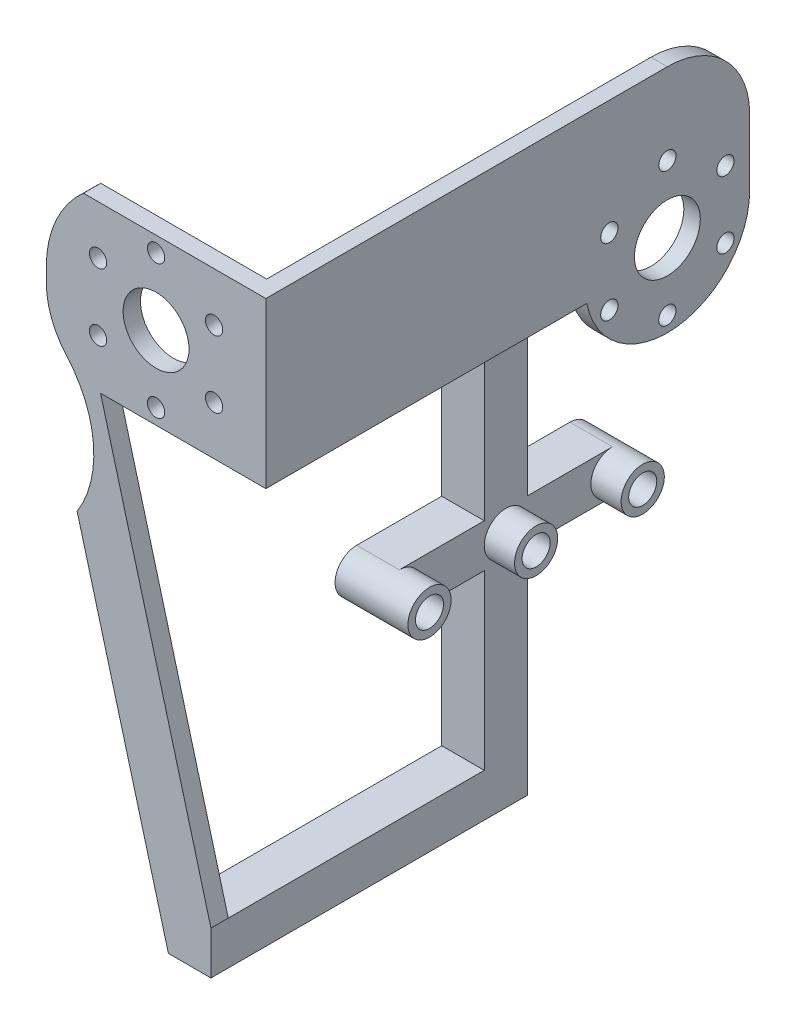
from build123d import *

# Parameters (mm, degrees)
SKETCH1_W                = 50.8
SKETCH1_H                = 38.1
SKETCH1_R                = 2
SKETCH1_R_2              = 7.62
BOSS_EXTRUDE1_DEPTH      = 4
CUT_EXTRUDE1_REACH       = 34.001
SKETCH4_R                = 19.05
SKETCH4_W                = 92.9
SKETCH4_H                = 38.1
SKETCH4_W_2              = 38.1
SKETCH4_H_2              = 15.24
BOSS_EXTRUDE2_DEPTH      = 3.81
CUT_EXTRUDE2_REACH       = 126.136
SKETCH5_R                = 7.62
SKETCH5_R_2              = 2
SKETCH6_W                = 19.05
SKETCH6_H                = 10
BOSS_EXTRUDE3_DEPTH      = 10
BOSS_EXTRUDE6_DEPTH      = 3.5
BOSS_EXTRUDE6_DEPTH_BACK = 6.35
SKETCH9_R                = 3.25
BOSS_EXTRUDE7_START      = 7
SKETCH10_R               = 5
SKETCH10_R_2             = 3.25
BOSS_EXTRUDE7_DEPTH      = 7
SKETCH11_W               = 10
SKETCH11_H               = 10
BOSS_EXTRUDE8_DEPTH      = 3.5
SKETCH12_W               = 63.23488816
SKETCH12_H               = 10
BOSS_EXTRUDE9_DEPTH      = 9.85
BOSS_EXTRUDE11_DEPTH     = 4
CUT_EXTRUDE3_DEPTH       = 4


with BuildPart() as part:
    # Sketch1 → Boss-Extrude1 (new body)
    with BuildSketch(Plane.XY):
        Rectangle(SKETCH1_W, SKETCH1_H)
        with Locations((0, 15.5)):
            Circle(SKETCH1_R, mode=Mode.SUBTRACT)
        with Locations((13.423393759, 7.75)):
            Circle(SKETCH1_R, mode=Mode.SUBTRACT)
        with Locations((13.423393759, -7.75)):
            Circle(SKETCH1_R, mode=Mode.SUBTRACT)
        with Locations((0, -15.5)):
            Circle(SKETCH1_R, mode=Mode.SUBTRACT)
        with Locations((-13.423393759, -7.75)):
            Circle(SKETCH1_R, mode=Mode.SUBTRACT)
        with Locations((-13.423393759, 7.75)):
            Circle(SKETCH1_R, mode=Mode.SUBTRACT)
        Circle(SKETCH1_R_2, mode=Mode.SUBTRACT)
    extrude(amount=BOSS_EXTRUDE1_DEPTH)

    # Sketch2 → Cut-Extrude1 (cut, up to next)
    with BuildSketch(Plane.XY.offset(4), mode=Mode.PRIVATE) as cut_extrude1_sk1:
        with BuildLine():
            Line((-16.800520825, 19.05), (-25.4, 19.05))
            Line((-25.4, 19.05), (-25.4, 0))
            ThreePointArc((-25.4, 0), (-23.150520825, 10.450520825), (-16.800520825, 19.05))
        make_face()
    cut_extrude1_tool1 = extrude(cut_extrude1_sk1.sketch, amount=-CUT_EXTRUDE1_REACH, mode=Mode.PRIVATE) & part.part
    add(cut_extrude1_tool1.solids().sort_by_distance((-22.917267, 14.463782, 4))[0], mode=Mode.SUBTRACT)

    # Sketch4 → Boss-Extrude2 (add)
    with BuildSketch(Plane(origin=(25.4, 0, 0), x_dir=(0, 0, -1), z_dir=(1, 0, 0))):
        with Locations((88.9, 0)):
            Circle(SKETCH4_R)
        with Locations((88.9, -15.24)):
            Circle(SKETCH4_R)
        with Locations((42.45, 0)):
            Rectangle(SKETCH4_W, SKETCH4_H)
        with Locations((88.9, -7.62)):
            Rectangle(SKETCH4_W_2, SKETCH4_H_2)
    extrude(amount=-BOSS_EXTRUDE2_DEPTH)

    # Sketch5 → Cut-Extrude2 (cut, up to next)
    with BuildSketch(Plane(origin=(25.4, 0, 0), x_dir=(0, 0, -1), z_dir=(1, 0, 0)), mode=Mode.PRIVATE) as cut_extrude2_sk1:
        with Locations((88.9, -15.24)):
            Circle(SKETCH5_R)
    cut_extrude2_tool1 = extrude(cut_extrude2_sk1.sketch, amount=-CUT_EXTRUDE2_REACH, mode=Mode.PRIVATE) & part.part
    # Sketch5 → Cut-Extrude2 (cut, up to next)
    with BuildSketch(Plane(origin=(25.4, 0, 0), x_dir=(0, 0, -1), z_dir=(1, 0, 0)), mode=Mode.PRIVATE) as cut_extrude2_sk2:
        with Locations((88.9, 0.26)):
            Circle(SKETCH5_R_2)
    cut_extrude2_tool2 = extrude(cut_extrude2_sk2.sketch, amount=-CUT_EXTRUDE2_REACH, mode=Mode.PRIVATE) & part.part
    # Sketch5 → Cut-Extrude2 (cut, up to next)
    with BuildSketch(Plane(origin=(25.4, 0, 0), x_dir=(0, 0, -1), z_dir=(1, 0, 0)), mode=Mode.PRIVATE) as cut_extrude2_sk3:
        with Locations((102.323393759, -7.49)):
            Circle(SKETCH5_R_2)
    cut_extrude2_tool3 = extrude(cut_extrude2_sk3.sketch, amount=-CUT_EXTRUDE2_REACH, mode=Mode.PRIVATE) & part.part
    # Sketch5 → Cut-Extrude2 (cut, up to next)
    with BuildSketch(Plane(origin=(25.4, 0, 0), x_dir=(0, 0, -1), z_dir=(1, 0, 0)), mode=Mode.PRIVATE) as cut_extrude2_sk4:
        with Locations((102.323393759, -22.99)):
            Circle(SKETCH5_R_2)
    cut_extrude2_tool4 = extrude(cut_extrude2_sk4.sketch, amount=-CUT_EXTRUDE2_REACH, mode=Mode.PRIVATE) & part.part
    # Sketch5 → Cut-Extrude2 (cut, up to next)
    with BuildSketch(Plane(origin=(25.4, 0, 0), x_dir=(0, 0, -1), z_dir=(1, 0, 0)), mode=Mode.PRIVATE) as cut_extrude2_sk5:
        with Locations((88.9, -30.74)):
            Circle(SKETCH5_R_2)
    cut_extrude2_tool5 = extrude(cut_extrude2_sk5.sketch, amount=-CUT_EXTRUDE2_REACH, mode=Mode.PRIVATE) & part.part
    # Sketch5 → Cut-Extrude2 (cut, up to next)
    with BuildSketch(Plane(origin=(25.4, 0, 0), x_dir=(0, 0, -1), z_dir=(1, 0, 0)), mode=Mode.PRIVATE) as cut_extrude2_sk6:
        with Locations((75.476606241, -22.99)):
            Circle(SKETCH5_R_2)
    cut_extrude2_tool6 = extrude(cut_extrude2_sk6.sketch, amount=-CUT_EXTRUDE2_REACH, mode=Mode.PRIVATE) & part.part
    # Sketch5 → Cut-Extrude2 (cut, up to next)
    with BuildSketch(Plane(origin=(25.4, 0, 0), x_dir=(0, 0, -1), z_dir=(1, 0, 0)), mode=Mode.PRIVATE) as cut_extrude2_sk7:
        with Locations((75.476606241, -7.49)):
            Circle(SKETCH5_R_2)
    cut_extrude2_tool7 = extrude(cut_extrude2_sk7.sketch, amount=-CUT_EXTRUDE2_REACH, mode=Mode.PRIVATE) & part.part
    add(cut_extrude2_tool1.solids().sort_by_distance((25.4, -15.24, -88.9))[0], mode=Mode.SUBTRACT)
    add(cut_extrude2_tool2.solids().sort_by_distance((25.4, 0.26, -88.9))[0], mode=Mode.SUBTRACT)
    add(cut_extrude2_tool3.solids().sort_by_distance((25.4, -7.49, -102.323394))[0], mode=Mode.SUBTRACT)
    add(cut_extrude2_tool4.solids().sort_by_distance((25.4, -22.99, -102.323394))[0], mode=Mode.SUBTRACT)
    add(cut_extrude2_tool5.solids().sort_by_distance((25.4, -30.74, -88.9))[0], mode=Mode.SUBTRACT)
    add(cut_extrude2_tool6.solids().sort_by_distance((25.4, -22.99, -75.476606))[0], mode=Mode.SUBTRACT)
    add(cut_extrude2_tool7.solids().sort_by_distance((25.4, -7.49, -75.476606))[0], mode=Mode.SUBTRACT)

    # Sketch6 → Boss-Extrude3 (add)
    with BuildSketch(Plane.XZ.offset(19.05)):
        with Locations((15.875, -64.23488816)):
            Rectangle(SKETCH6_W, SKETCH6_H)
    extrude(amount=-BOSS_EXTRUDE3_DEPTH)

    # Sketch9 → Boss-Extrude6 (add, two sides: drawn at the far end of the back side and taken through both)
    with BuildSketch(Plane.ZY.offset(-6.35).offset(-BOSS_EXTRUDE6_DEPTH_BACK)):
        with BuildLine():
            Line((-59.23488816, -19.05), (-69.23488816, -19.05))
            Line((-69.23488816, -19.05), (-69.23488816, -63.45))
            Line((-69.23488816, -63.45), (-88.9, -63.45))
            ThreePointArc((-88.9, -63.45), (-93.9, -68.45), (-88.9, -73.45))
            Line((-88.9, -73.45), (-64.23488816, -73.45))
            Line((-64.23488816, -73.45), (-39.56977632, -73.45))
            ThreePointArc((-39.56977632, -73.45), (-34.56977632, -68.45), (-39.56977632, -63.45))
            Line((-39.56977632, -63.45), (-59.23488816, -63.45))
            Line((-59.23488816, -63.45), (-59.23488816, -19.05))
        make_face()
        with Locations((-88.9, -68.45)):
            Circle(SKETCH9_R, mode=Mode.SUBTRACT)
        with BuildLine():
            ThreePointArc((-60.98488816, -68.45), (-61.936791121, -70.748097039), (-64.23488816, -71.7))
            ThreePointArc((-64.23488816, -71.7), (-67.48488816, -68.45), (-64.23488816, -65.2))
            ThreePointArc((-64.23488816, -65.2), (-61.936791121, -66.151902961), (-60.98488816, -68.45))
        make_face(mode=Mode.SUBTRACT)
        with Locations((-39.56977632, -68.45)):
            Circle(SKETCH9_R, mode=Mode.SUBTRACT)
    extrude(amount=BOSS_EXTRUDE6_DEPTH + BOSS_EXTRUDE6_DEPTH_BACK)

    # Sketch10 → Boss-Extrude7 (add)
    # profile 1 of 3: a face of its own
    with BuildSketch(Plane(origin=(12.7, 0, 0), x_dir=(0, 0, -1), z_dir=(1, 0, 0)).offset(BOSS_EXTRUDE7_START)):
        with Locations(Location((64.23488816, -68.45, 0), (0, 0, 270))):
            Circle(SKETCH10_R)
        with Locations((64.23488816, -68.45)):
            Circle(SKETCH10_R_2, mode=Mode.SUBTRACT)
    # profile 2 of 3: a face of its own
    with BuildSketch(Plane(origin=(12.7, 0, 0), x_dir=(0, 0, -1), z_dir=(1, 0, 0)).offset(BOSS_EXTRUDE7_START)):
        with Locations((39.56977632, -68.45)):
            Circle(SKETCH10_R)
        with Locations((39.56977632, -68.45)):
            Circle(SKETCH10_R_2, mode=Mode.SUBTRACT)
    # profile 3 of 3: a face of its own
    with BuildSketch(Plane(origin=(12.7, 0, 0), x_dir=(0, 0, -1), z_dir=(1, 0, 0)).offset(BOSS_EXTRUDE7_START)):
        with Locations((88.9, -68.45)):
            Circle(SKETCH10_R)
        with Locations((88.9, -68.45)):
            Circle(SKETCH10_R_2, mode=Mode.SUBTRACT)
    extrude(amount=-BOSS_EXTRUDE7_DEPTH)

    # Sketch11 → Boss-Extrude8 (add)
    with BuildSketch(Plane.ZY.offset(-6.35)):
        with Locations((-64.23488816, -14.05)):
            Rectangle(SKETCH11_W, SKETCH11_H)
    extrude(amount=BOSS_EXTRUDE8_DEPTH)

    # Sketch12 → Boss-Extrude9 (add)
    with BuildSketch(Plane.ZY.offset(-2.85)):
        Polygon((-59.23488816, -73.45), (-69.23488816, -73.45), (-69.23488816, -123.45), (-59.23488816, -123.45), (-59.23488816, -113.45), align=None)
        with Locations((-27.61744408, -118.45)):
            Rectangle(SKETCH12_W, SKETCH12_H)
    extrude(amount=-BOSS_EXTRUDE9_DEPTH)

    # Sketch14 → Boss-Extrude11 (add)
    with BuildSketch(Plane.XY.offset(4)):
        Polygon((-25.4, -19.05), (2.85, -123.45), (12.7, -113.45), (-12.844061303, -19.05), align=None)
    extrude(amount=-BOSS_EXTRUDE11_DEPTH)

    # Sketch15 → Cut-Extrude3 (cut)
    with BuildSketch(Plane.XY.offset(4)):
        with BuildLine():
            Line((-25.4, -3.05), (-39.4, -3.05))
            Line((-39.4, -3.05), (-39.4, -7.05))
            ThreePointArc((-39.4, -7.05), (-49.632651229, -54.859928734), (-20.727516377, -15.426572093))
            ThreePointArc((-20.727516377, -15.426572093), (-24.210390488, -9.671170096), (-25.4, -3.05))
        make_face()
    extrude(amount=-CUT_EXTRUDE3_DEPTH, mode=Mode.SUBTRACT)


solid = part.part
